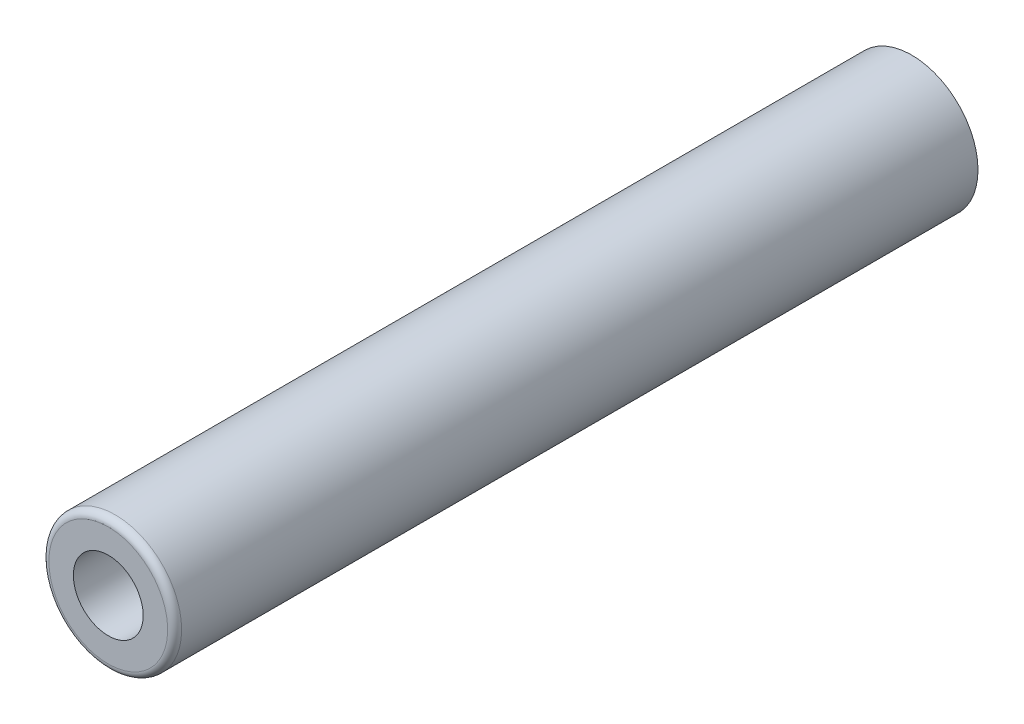
from build123d import *

# Parameters (mm, degrees)
FILLET1_R = 2


with BuildPart() as part:
    # Sketch1 → Revolve1 (revolve)
    with BuildSketch(Plane.YZ, mode=Mode.PRIVATE) as revolve1_sk:
        Polygon((10, 115), (19, 115), (19, -115), (15, -115), (15, 75), (10, 75), align=None)
    revolve(revolve1_sk.sketch.rotate(Axis((0, 0, 319.317365216), (0, 0, -1)), 90), axis=Axis((0, 0, 319.317365216), (0, 0, -1)))

    # Fillet1
    fillet1_edges = [part.edges().sort_by_distance(p)[0] for p in [
        (-19, 0, 115),
    ]]
    fillet(fillet1_edges, radius=FILLET1_R)


solid = part.part
